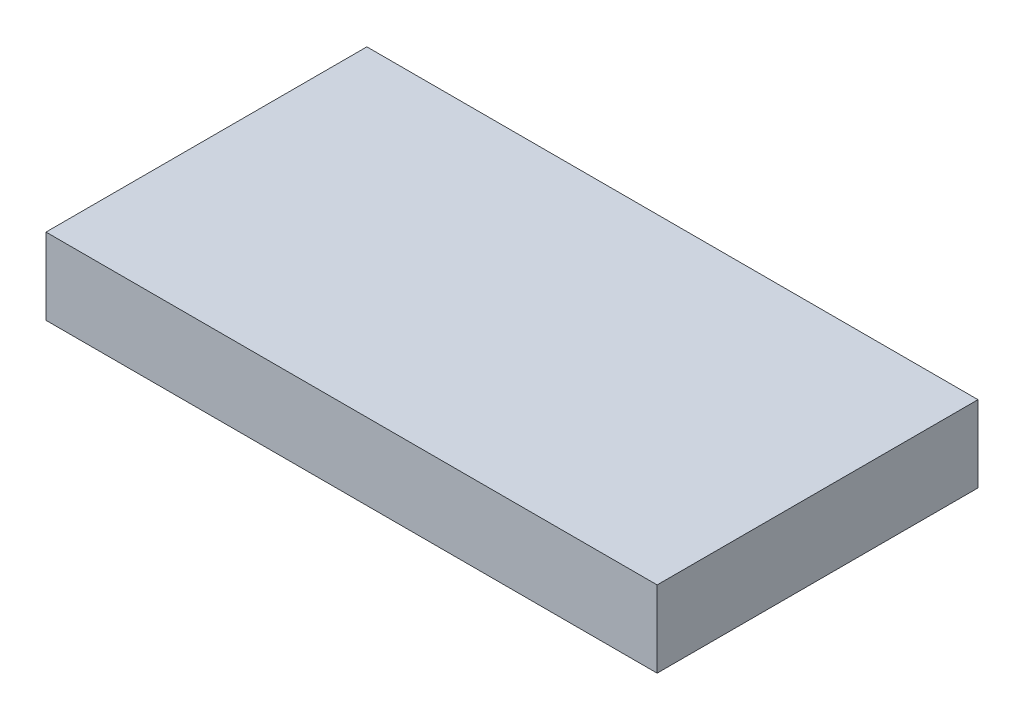
from build123d import *

# Parameters (mm, degrees)
SKETCH1_W           = 101.52
SKETCH1_H           = 53.3
BOSS_EXTRUDE1_DEPTH = 12.7


with BuildPart() as part:
    # Sketch1 → Boss-Extrude1 (new body)
    with BuildSketch(Plane(origin=(0, 0, 0), x_dir=(1, 0, 0), z_dir=(0, 1, 0))):
        with Locations((50.76, 26.65)):
            Rectangle(SKETCH1_W, SKETCH1_H)
    extrude(amount=BOSS_EXTRUDE1_DEPTH)


solid = part.part
